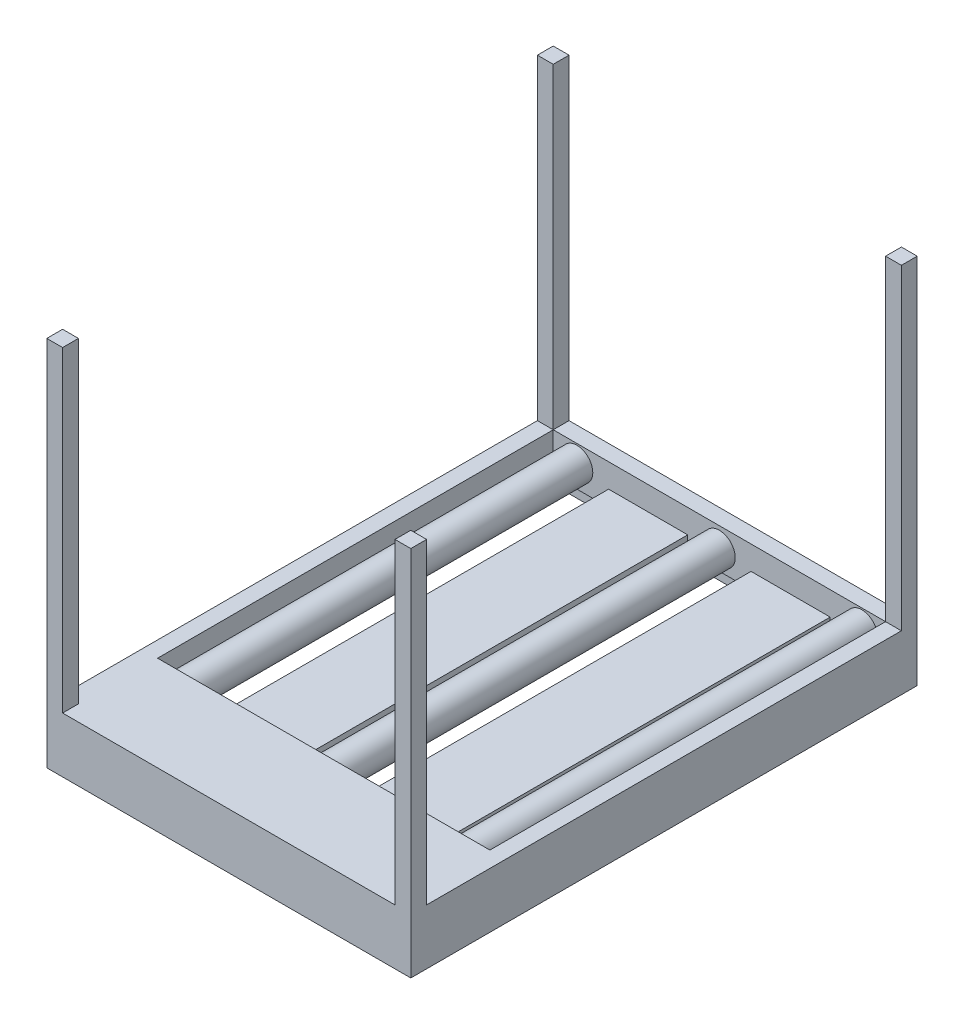
from build123d import *

# Parameters (mm, degrees)
SKETCH1_W                = 250
SKETCH1_H                = 50
BOSS_EXTRUDE1_DEPTH      = 1500
BOSS_EXTRUDE1_2_DEPTH    = 1500
BOSS_EXTRUDE1_3_DEPTH    = 1500
BOSS_EXTRUDE2_DEPTH      = 50
BOSS_EXTRUDE2_DEPTH_BACK = 75
SKETCH2_W                = 1150
SKETCH2_H                = 1600
SKETCH2_W_2              = 1050
SKETCH2_H_2              = 1500
SKETCH3_W                = 50
SKETCH3_H                = 50
BOSS_EXTRUDE3_DEPTH      = 1000
SKETCH4_W                = 1050
SKETCH4_H                = 1500
CUT_EXTRUDE1_DEPTH       = 134
SKETCH5_W                = 250
SKETCH5_H                = 50
SKETCH5_R                = 50
BOSS_EXTRUDE4_DEPTH      = 1500
SKETCH6_R                = 25
CUT_EXTRUDE3_DEPTH       = 75
SKETCH7_W                = 250
SKETCH7_H                = 125
BOSS_EXTRUDE5_DEPTH      = 1150
SKETCH8_W                = 1150
SKETCH8_H                = 1600
SKETCH8_W_2              = 1100
SKETCH8_H_2              = 1550
BOSS_EXTRUDE6_DEPTH      = 50


with BuildPart() as part:
    # Sketch1 → Boss-Extrude1 (new body)
    with BuildSketch(Plane.XY):
        with Locations((925, -25)):
            Rectangle(SKETCH1_W, SKETCH1_H)
    extrude(amount=BOSS_EXTRUDE1_DEPTH)



with BuildPart() as body_2:
    # Sketch1 → Boss-Extrude1 2 (new body)
    with BuildSketch(Plane.XY):
        with Locations((525, -25)):
            Rectangle(SKETCH1_W, SKETCH1_H)
    extrude(amount=BOSS_EXTRUDE1_2_DEPTH)


with BuildPart() as body_3:
    # Sketch1 → Boss-Extrude1 3 (new body)
    with BuildSketch(Plane.XY):
        with Locations((125, -25)):
            Rectangle(SKETCH1_W, SKETCH1_H)
    extrude(amount=BOSS_EXTRUDE1_3_DEPTH)


with BuildPart() as part_1:
    add(part.part)

    add(body_2.part)  # Boss-Extrude2 merges body 2

    add(body_3.part)  # Boss-Extrude2 merges body 3
    # Sketch2 → Boss-Extrude2 (add, two sides: drawn at the far end of the back side and taken through both)
    with BuildSketch(Plane(origin=(0, 0, 0), x_dir=(1, 0, 0), z_dir=(0, 1, 0)).offset(-BOSS_EXTRUDE2_DEPTH_BACK)):
        with Locations((525, -750)):
            Rectangle(SKETCH2_W, SKETCH2_H)
        with Locations((525, -750)):
            Rectangle(SKETCH2_W_2, SKETCH2_H_2, mode=Mode.SUBTRACT)
    extrude(amount=BOSS_EXTRUDE2_DEPTH + BOSS_EXTRUDE2_DEPTH_BACK)

    # Sketch3 → Boss-Extrude3 (add)
    with BuildSketch(Plane(origin=(0, 50, 0), x_dir=(1, 0, 0), z_dir=(0, 1, 0))):
        with Locations((-25, 25)):
            Rectangle(SKETCH3_W, SKETCH3_H)
        with Locations((1075, 25)):
            Rectangle(SKETCH3_W, SKETCH3_H)
        with Locations((-25, -1525)):
            Rectangle(SKETCH3_W, SKETCH3_H)
        with Locations((1075, -1525)):
            Rectangle(SKETCH3_W, SKETCH3_H)
    extrude(amount=BOSS_EXTRUDE3_DEPTH)

    # Sketch4 → Cut-Extrude1 (cut)
    with BuildSketch(Plane.XZ.offset(50)):
        with Locations((525, 750)):
            Rectangle(SKETCH4_W, SKETCH4_H)
    extrude(amount=-CUT_EXTRUDE1_DEPTH, mode=Mode.SUBTRACT)

    # Sketch5 → Boss-Extrude4 (add)
    with BuildSketch(Plane.XY):
        with BuildLine():
            ThreePointArc((525, 37.5), (475, -12.5), (525, -62.5))
            Line((525, -62.5), (525, 37.5))
        make_face()
        with BuildLine():
            Line((525, 37.5), (525, -62.5))
            ThreePointArc((525, -62.5), (560.355339059, -47.855339059), (575, -12.5))
            ThreePointArc((575, -12.5), (560.355339059, 22.855339059), (525, 37.5))
        make_face()
        with Locations((300, -50)):
            Rectangle(SKETCH5_W, SKETCH5_H)
        with Locations((750, -50)):
            Rectangle(SKETCH5_W, SKETCH5_H)
        with Locations((975, -5)):
            Circle(SKETCH5_R)
        with Locations((75, -5)):
            Circle(SKETCH5_R)
    extrude(amount=BOSS_EXTRUDE4_DEPTH)

    # Sketch6 → Cut-Extrude3 (cut)
    with BuildSketch(Plane(origin=(0, 0, 0), x_dir=(1, 0, 0), z_dir=(0, 1, 0))):
        with Locations(Location((975, -1425, 0), (0, 0, 270))):
            Circle(SKETCH6_R)
        with Locations(Location((975, -1275, 0), (0, 0, 270))):
            Circle(SKETCH6_R)
        with Locations(Location((975, -1125, 0), (0, 0, 270))):
            Circle(SKETCH6_R)
        with Locations(Location((975, -975, 0), (0, 0, 270))):
            Circle(SKETCH6_R)
        with Locations(Location((975, -825, 0), (0, 0, 270))):
            Circle(SKETCH6_R)
        with Locations(Location((975, -675, 0), (0, 0, 270))):
            Circle(SKETCH6_R)
        with Locations(Location((975, -525, 0), (0, 0, 270))):
            Circle(SKETCH6_R)
        with Locations(Location((975, -375, 0), (0, 0, 270))):
            Circle(SKETCH6_R)
        with Locations(Location((975, -225, 0), (0, 0, 270))):
            Circle(SKETCH6_R)
        with Locations(Location((975, -75, 0), (0, 0, 270))):
            Circle(SKETCH6_R)
        with Locations(Location((525, -1425, 0), (0, 0, 270))):
            Circle(SKETCH6_R)
        with Locations(Location((75, -1425, 0), (0, 0, 270))):
            Circle(SKETCH6_R)
        with Locations(Location((525, -1275, 0), (0, 0, 270))):
            Circle(SKETCH6_R)
        with Locations(Location((75, -1275, 0), (0, 0, 270))):
            Circle(SKETCH6_R)
        with Locations(Location((525, -1125, 0), (0, 0, 270))):
            Circle(SKETCH6_R)
        with Locations(Location((75, -1125, 0), (0, 0, 270))):
            Circle(SKETCH6_R)
        with Locations(Location((525, -975, 0), (0, 0, 270))):
            Circle(SKETCH6_R)
        with Locations(Location((75, -975, 0), (0, 0, 270))):
            Circle(SKETCH6_R)
        with Locations(Location((525, -825, 0), (0, 0, 270))):
            Circle(SKETCH6_R)
        with Locations(Location((75, -825, 0), (0, 0, 270))):
            Circle(SKETCH6_R)
        with Locations(Location((525, -675, 0), (0, 0, 270))):
            Circle(SKETCH6_R)
        with Locations(Location((75, -675, 0), (0, 0, 270))):
            Circle(SKETCH6_R)
        with Locations(Location((525, -525, 0), (0, 0, 270))):
            Circle(SKETCH6_R)
        with Locations(Location((75, -525, 0), (0, 0, 270))):
            Circle(SKETCH6_R)
        with Locations(Location((525, -375, 0), (0, 0, 270))):
            Circle(SKETCH6_R)
        with Locations(Location((75, -375, 0), (0, 0, 270))):
            Circle(SKETCH6_R)
        with Locations(Location((525, -225, 0), (0, 0, 270))):
            Circle(SKETCH6_R)
        with Locations(Location((75, -225, 0), (0, 0, 270))):
            Circle(SKETCH6_R)
        with Locations(Location((525, -75, 0), (0, 0, 270))):
            Circle(SKETCH6_R)
        with Locations(Location((75, -75, 0), (0, 0, 270))):
            Circle(SKETCH6_R)
    extrude(amount=-CUT_EXTRUDE3_DEPTH, mode=Mode.SUBTRACT)

    # Sketch7 → Boss-Extrude5 (add)
    with BuildSketch(Plane.ZY.offset(50)):
        with Locations((1375, -12.5)):
            Rectangle(SKETCH7_W, SKETCH7_H)
    extrude(amount=-BOSS_EXTRUDE5_DEPTH)

    # Sketch8 → Boss-Extrude6 (add)
    with BuildSketch(Plane.XZ.offset(75)):
        with Locations((525, 750)):
            Rectangle(SKETCH8_W, SKETCH8_H)
        with Locations((525, 750)):
            Rectangle(SKETCH8_W_2, SKETCH8_H_2, mode=Mode.SUBTRACT)
    extrude(amount=BOSS_EXTRUDE6_DEPTH)


solid = part_1.part
